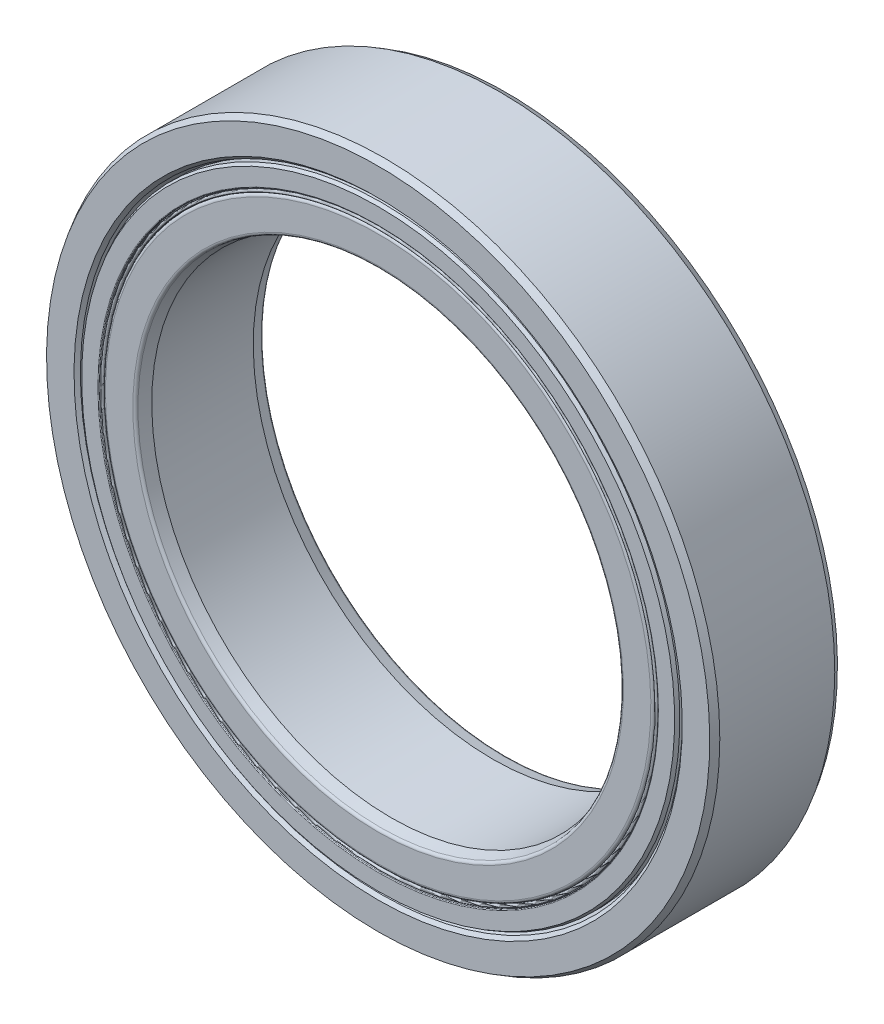
from build123d import *

# Parameters (mm, degrees)
CIRPATTERN1_COUNT = 16


with BuildPart() as part:
    # Sketch3 → Revolve1 (revolve)
    with BuildSketch(Plane(origin=(0, 0, 0), x_dir=(0, 0, -1), z_dir=(1, 0, 0)), mode=Mode.PRIVATE) as revolve1_sk:
        with BuildLine():
            Line((-1.682987285, 9.345), (-1.9, 9.423986169))
            Line((-1.9, 9.423986169), (-2, 9.523986169))
            Line((-2, 9.523986169), (-2, 10.384529946))
            Line((-2, 10.384529946), (-1.8, 10.5))
            Line((-1.8, 10.5), (1.8, 10.5))
            Line((1.8, 10.5), (2, 10.384529946))
            Line((2, 10.384529946), (2, 9.523986169))
            Line((2, 9.523986169), (1.9, 9.423986169))
            Line((1.9, 9.423986169), (1.682987285, 9.345))
            Line((1.682987285, 9.345), (1.067520492, 9.345))
            ThreePointArc((1.067520492, 9.345), (0, 10.115), (-1.067520492, 9.345))
            Line((-1.067520492, 9.345), (-1.682987285, 9.345))
        make_face()
    revolve(revolve1_sk.sketch.rotate(Axis((0, 0, 2), (0, 0, -1)), 180), axis=Axis((0, 0, 2), (0, 0, -1)))


with BuildPart() as body_2:
    # Sketch4 → Revolve2 (revolve)
    with BuildSketch(Plane(origin=(0, 0, 0), x_dir=(0, 0, -1), z_dir=(1, 0, 0)), mode=Mode.PRIVATE) as revolve2_sk:
        with BuildLine():
            Line((-1.589431776, 7.5), (-1.929981412, 7.59125))
            ThreePointArc((-1.929981412, 7.59125), (-1.980478307, 7.624990946), (-2, 7.6825))
            Line((-2, 7.6825), (-2, 8.540531049))
            ThreePointArc((-2, 8.540531049), (-1.972330685, 8.607330685), (-1.905531049, 8.635))
            Line((-1.905531049, 8.635), (-1.067520492, 8.635))
            ThreePointArc((-1.067520492, 8.635), (0, 7.865), (1.067520492, 8.635))
            Line((1.067520492, 8.635), (1.905531049, 8.635))
            ThreePointArc((1.905531049, 8.635), (1.972330685, 8.607330685), (2, 8.540531049))
            Line((2, 8.540531049), (2, 7.6825))
            ThreePointArc((2, 7.6825), (1.980478307, 7.624990946), (1.929981412, 7.59125))
            Line((1.929981412, 7.59125), (1.589431776, 7.5))
            Line((1.589431776, 7.5), (-1.589431776, 7.5))
        make_face()
    revolve(revolve2_sk.sketch.rotate(Axis((0, 0, 2), (0, 0, -1)), 180), axis=Axis((0, 0, 2), (0, 0, -1)))


with BuildPart() as body_3:
    # Sketch5 → Revolve3 (revolve)
    with BuildSketch(Plane(origin=(0, 0, 0), x_dir=(0, 0, -1), z_dir=(1, 0, 0))):
        with BuildLine():
            Line((-1.125, 8.99), (1.125, 8.99))
            ThreePointArc((1.125, 8.99), (0, 10.115), (-1.125, 8.99))
        make_face()
    revolve(axis=Axis((0, 8.99, 1.125), (0, 0, -1)))


with BuildPart() as cirpattern1_1:
    # CirPattern1: pattern copy
    add(body_3.part.rotate(Axis((0, 0, 0), (0, 0, 1)), 1 * 360 / CIRPATTERN1_COUNT))


with BuildPart() as cirpattern1_2:
    # CirPattern1: pattern copy
    add(body_3.part.rotate(Axis((0, 0, 0), (0, 0, 1)), 2 * 360 / CIRPATTERN1_COUNT))


with BuildPart() as cirpattern1_3:
    # CirPattern1: pattern copy
    add(body_3.part.rotate(Axis((0, 0, 0), (0, 0, 1)), 3 * 360 / CIRPATTERN1_COUNT))


with BuildPart() as cirpattern1_4:
    # CirPattern1: pattern copy
    add(body_3.part.rotate(Axis((0, 0, 0), (0, 0, 1)), 4 * 360 / CIRPATTERN1_COUNT))


with BuildPart() as cirpattern1_5:
    # CirPattern1: pattern copy
    add(body_3.part.rotate(Axis((0, 0, 0), (0, 0, 1)), 5 * 360 / CIRPATTERN1_COUNT))


with BuildPart() as cirpattern1_6:
    # CirPattern1: pattern copy
    add(body_3.part.rotate(Axis((0, 0, 0), (0, 0, 1)), 6 * 360 / CIRPATTERN1_COUNT))


with BuildPart() as cirpattern1_7:
    # CirPattern1: pattern copy
    add(body_3.part.rotate(Axis((0, 0, 0), (0, 0, 1)), 7 * 360 / CIRPATTERN1_COUNT))


with BuildPart() as cirpattern1_8:
    # CirPattern1: pattern copy
    add(body_3.part.rotate(Axis((0, 0, 0), (0, 0, 1)), 8 * 360 / CIRPATTERN1_COUNT))


with BuildPart() as cirpattern1_9:
    # CirPattern1: pattern copy
    add(body_3.part.rotate(Axis((0, 0, 0), (0, 0, 1)), 9 * 360 / CIRPATTERN1_COUNT))


with BuildPart() as cirpattern1_10:
    # CirPattern1: pattern copy
    add(body_3.part.rotate(Axis((0, 0, 0), (0, 0, 1)), 10 * 360 / CIRPATTERN1_COUNT))


with BuildPart() as cirpattern1_11:
    # CirPattern1: pattern copy
    add(body_3.part.rotate(Axis((0, 0, 0), (0, 0, 1)), 11 * 360 / CIRPATTERN1_COUNT))


with BuildPart() as cirpattern1_12:
    # CirPattern1: pattern copy
    add(body_3.part.rotate(Axis((0, 0, 0), (0, 0, 1)), 12 * 360 / CIRPATTERN1_COUNT))


with BuildPart() as cirpattern1_13:
    # CirPattern1: pattern copy
    add(body_3.part.rotate(Axis((0, 0, 0), (0, 0, 1)), 13 * 360 / CIRPATTERN1_COUNT))


with BuildPart() as cirpattern1_14:
    # CirPattern1: pattern copy
    add(body_3.part.rotate(Axis((0, 0, 0), (0, 0, 1)), 14 * 360 / CIRPATTERN1_COUNT))


with BuildPart() as cirpattern1_15:
    # CirPattern1: pattern copy
    add(body_3.part.rotate(Axis((0, 0, 0), (0, 0, 1)), 15 * 360 / CIRPATTERN1_COUNT))


with BuildPart() as body_19:
    # Sketch6 → Revolve4 (revolve)
    with BuildSketch(Plane(origin=(0, 0, 0), x_dir=(0, 0, -1), z_dir=(1, 0, 0)), mode=Mode.PRIVATE) as revolve4_sk:
        with BuildLine():
            Line((-1.896076952, 9.345), (-1.125, 9.345))
            Line((-1.125, 9.345), (-1.125, 8.755))
            Line((-1.125, 8.755), (-1.976, 8.755))
            ThreePointArc((-1.976, 8.755), (-1.992970563, 8.762029437), (-2, 8.779))
            Line((-2, 8.779), (-2, 9.285))
            Line((-2, 9.285), (-1.896076952, 9.345))
        make_face()
        with BuildLine():
            Line((1.976, 8.755), (1.125, 8.755))
            Line((1.125, 8.755), (1.125, 9.345))
            Line((1.125, 9.345), (1.896076952, 9.345))
            Line((1.896076952, 9.345), (2, 9.285))
            Line((2, 9.285), (2, 8.779))
            ThreePointArc((2, 8.779), (1.992970563, 8.762029437), (1.976, 8.755))
        make_face()
    revolve(revolve4_sk.sketch.rotate(Axis((0, 0, 2), (0, 0, -1)), 180), axis=Axis((0, 0, 2), (0, 0, -1)))


with BuildPart() as body_20:
    # Sketch7 → Revolve5 (revolve)
    with BuildSketch(Plane(origin=(0, 0, 0), x_dir=(0, 0, -1), z_dir=(1, 0, 0)), mode=Mode.PRIVATE) as revolve5_sk:
        with BuildLine():
            Line((-1.125, 8.755), (-1.90262466, 8.755))
            Line((-1.90262466, 8.755), (-1.932168892, 8.749790555))
            ThreePointArc((-1.932168892, 8.749790555), (-1.942442625, 8.736401565), (-1.93, 8.725))
            Line((-1.93, 8.725), (-1.955, 8.725))
            ThreePointArc((-1.955, 8.725), (-2, 8.68), (-1.955, 8.635))
            Line((-1.955, 8.635), (-1.125, 8.635))
            Line((-1.125, 8.635), (-1.125, 8.755))
        make_face()
    revolve(revolve5_sk.sketch.rotate(Axis((0, 0, 2), (0, 0, -1)), 180), axis=Axis((0, 0, 2), (0, 0, -1)))


solid = Compound([part.part, body_2.part, body_3.part, cirpattern1_1.part, cirpattern1_2.part, cirpattern1_3.part, cirpattern1_4.part, cirpattern1_5.part, cirpattern1_6.part, cirpattern1_7.part, cirpattern1_8.part, cirpattern1_9.part, cirpattern1_10.part, cirpattern1_11.part, cirpattern1_12.part, cirpattern1_13.part, cirpattern1_14.part, cirpattern1_15.part, body_19.part, body_20.part])
